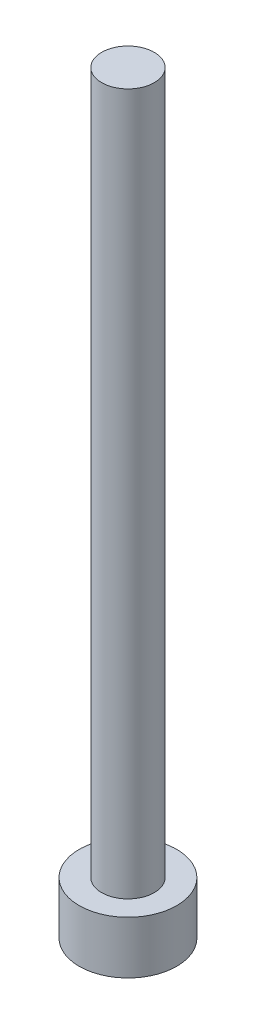
from build123d import *

# Parameters (mm, degrees)
SKETCH1_R           = 2.78
BOSS_EXTRUDE1_DEPTH = 3
SKETCH2_R           = 1.5
BOSS_EXTRUDE2_DEPTH = 40


with BuildPart() as part:
    # Sketch1 → Boss-Extrude1 (new body)
    with BuildSketch(Plane(origin=(0, 0, 0), x_dir=(1, 0, 0), z_dir=(0, 1, 0))):
        with Locations(Location((0, 0, 0), (0, 0, 270))):
            Circle(SKETCH1_R)
    extrude(amount=BOSS_EXTRUDE1_DEPTH)

    # Sketch2 → Boss-Extrude2 (add)
    with BuildSketch(Plane(origin=(0, 3, 0), x_dir=(1, 0, 0), z_dir=(0, 1, 0))):
        with Locations(Location((0, 0, 0), (0, 0, 270))):
            Circle(SKETCH2_R)
    extrude(amount=BOSS_EXTRUDE2_DEPTH)


solid = part.part
